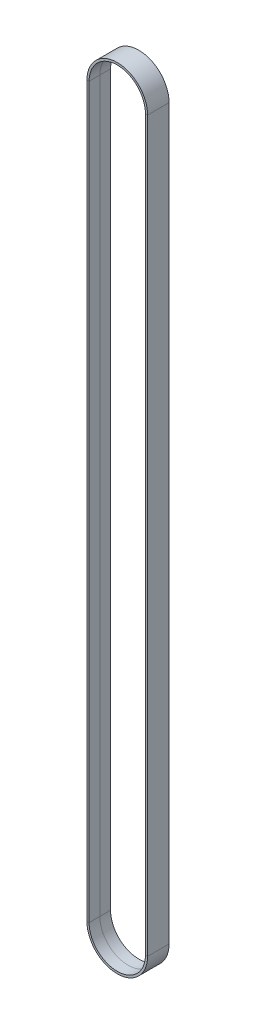
from build123d import *


with BuildPart() as part:
    # По траектории1: sweep along a path in Эскиз3
    with BuildLine(Plane.XY) as sweep_1_path:
        Line((-26.25, -678.678709754), (-26.25, 1e-09))
        ThreePointArc((-26.25, 1e-09), (0, 26.250000001), (26.25, 1e-09))
        Line((26.25, 1e-09), (26.25, -678.678709754))
        ThreePointArc((26.25, -678.678709754), (0, -704.928709754), (-26.25, -678.678709754))
    # Эскиз4 → По траектории1 (sweep)
    with BuildSketch(Plane(origin=(0, 0, 0), x_dir=(1, 0, 0), z_dir=(0, 1, 0))):
        Polygon((26.25, 0), (26.25, -10), (28.25, -10), (28.25, 10), (26.25, 10), align=None)
    sweep(path=sweep_1_path.line)


solid = part.part
